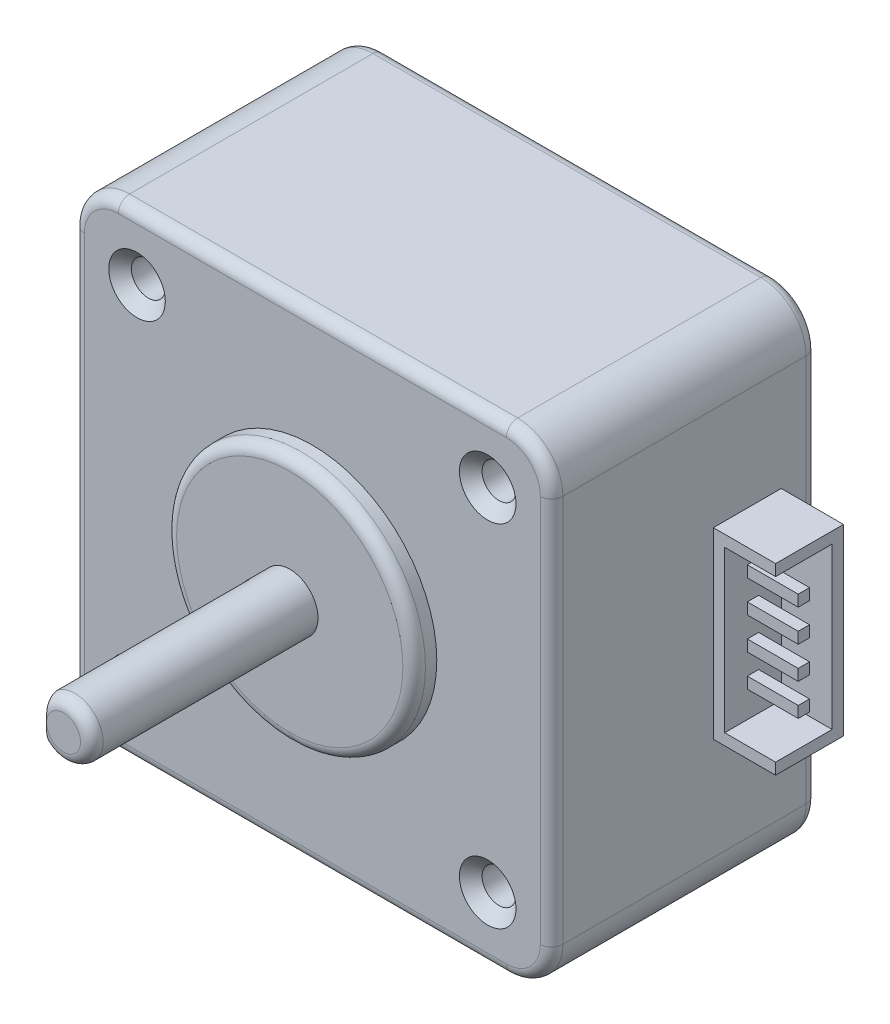
from build123d import *

# Parameters (mm, degrees)
SKETCH1_W                    = 42.3
SKETCH1_H                    = 42.3
BOSS_EXTRUDE1_DEPTH          = 23.5
FILLET1_R                    = 4
SKETCH2_R                    = 1.5
CUT_EXTRUDE1_DEPTH           = 5
CHAMFER1_SIZE                = 1
CIRPATTERN1_COUNT            = 4
CHAMFER1_OF_CIRPATTERN1_SIZE = 1
SKETCH3_R                    = 11
BOSS_EXTRUDE2_DEPTH          = 2
SKETCH4_R                    = 2.5
BOSS_EXTRUDE3_DEPTH          = 20
FILLET2_R                    = 1
SKETCH5_W                    = 6
SKETCH5_H                    = 16.2
BOSS_EXTRUDE4_DEPTH          = 1
SKETCH6_W                    = 1
SKETCH6_H                    = 1
BOSS_EXTRUDE5_DEPTH          = 4.5
SKETCH7_W                    = 4
SKETCH7_H                    = 4
CUT_EXTRUDE2_DEPTH           = 18


with BuildPart() as part:
    # Sketch1 → Boss-Extrude1 (new body)
    with BuildSketch(Plane.XY):
        Rectangle(SKETCH1_W, SKETCH1_H)
    extrude(amount=BOSS_EXTRUDE1_DEPTH)

    # Fillet1
    fillet1_edges = [part.edges().sort_by_distance(p)[0] for p in [
        (-21.15, 21.15, 11.75),
        (21.15, 21.15, 11.75),
        (21.15, -21.15, 11.75),
        (-21.15, -21.15, 11.75),
    ]]
    fillet(fillet1_edges, radius=FILLET1_R)

    # Sketch2 → Cut-Extrude1 (cut)
    with BuildSketch(Plane.XY.offset(23.5)):
        with Locations((-15.5, -15.5)):
            Circle(SKETCH2_R)
    cut_extrude1 = extrude(amount=-CUT_EXTRUDE1_DEPTH, mode=Mode.SUBTRACT)

    # Chamfer1
    chamfer1_edges = [part.edges().sort_by_distance(p)[0] for p in [
        (-17, -15.5, 23.5),
    ]]
    chamfer(chamfer1_edges, length=CHAMFER1_SIZE)

    # CirPattern1: Cut-Extrude1 ×4 about axis
    cirpattern1_axis = Axis((0, 0, 23.5), (0, 0, 1))
    for i in range(1, CIRPATTERN1_COUNT):
        add(cut_extrude1.rotate(cirpattern1_axis, i * 360 / CIRPATTERN1_COUNT), mode=Mode.SUBTRACT)

    # Chamfer1 of CirPattern1
    chamfer1_of_cirpattern1_edges = [part.edges().sort_by_distance(p)[0] for p in [
        (15.5, -17, 23.5),
        (17, 15.5, 23.5),
        (-15.5, 17, 23.5),
    ]]
    chamfer(chamfer1_of_cirpattern1_edges, length=CHAMFER1_OF_CIRPATTERN1_SIZE)

    # Sketch3 → Boss-Extrude2 (add)
    with BuildSketch(Plane.XY.offset(23.5)):
        Circle(SKETCH3_R)
    extrude(amount=BOSS_EXTRUDE2_DEPTH)

    # Sketch4 → Boss-Extrude3 (add)
    with BuildSketch(Plane.XY.offset(25.5)):
        Circle(SKETCH4_R)
    extrude(amount=BOSS_EXTRUDE3_DEPTH)

    # Fillet2
    fillet2_edges = [part.edges().sort_by_distance(p)[0] for p in [
        (19.978427125, -19.978427125, 0),
        (0, -21.15, 0),
        (-19.978427125, -19.978427125, 0),
        (-21.15, 0, 0),
        (-19.978427125, 19.978427125, 0),
        (0, 21.15, 0),
        (19.978427125, 19.978427125, 0),
        (19.978427125, 19.978427125, 23.5),
        (21.15, 0, 23.5),
        (19.978427125, -19.978427125, 23.5),
        (0, -21.15, 23.5),
        (-19.978427125, -19.978427125, 23.5),
        (-21.15, 0, 23.5),
        (-19.978427125, 19.978427125, 23.5),
        (21.15, 0, 0),
        (0, 21.15, 23.5),
        (-11, 0, 25.5),
        (-2.5, 0, 45.5),
    ]]
    fillet(fillet2_edges, radius=FILLET2_R)

    # Sketch5 → Boss-Extrude4 (add)
    with BuildSketch(Plane(origin=(21.15, 0, 0), x_dir=(0, 0, -1), z_dir=(1, 0, 0))):
        with Locations((-6.2, 0)):
            Rectangle(SKETCH5_W, SKETCH5_H)
    extrude(amount=BOSS_EXTRUDE4_DEPTH)

    # Sketch6 → Boss-Extrude5 (add)
    with BuildSketch(Plane(origin=(22.15, 0, 0), x_dir=(0, 0, -1), z_dir=(1, 0, 0))):
        Polygon((-9.2, -7.1), (-4.2, -7.1), (-4.2, 7.1), (-9.2, 7.1), (-9.2, 8.1), (-3.2, 8.1), (-3.2, -8.1), (-9.2, -8.1), align=None)
        with Locations((-6.7, -4.26)):
            Rectangle(SKETCH6_W, SKETCH6_H)
        with Locations((-6.7, 1.42)):
            Rectangle(SKETCH6_W, SKETCH6_H)
        with Locations((-6.7, 4.26)):
            Rectangle(SKETCH6_W, SKETCH6_H)
        with Locations((-6.7, -1.42)):
            Rectangle(SKETCH6_W, SKETCH6_H)
    extrude(amount=BOSS_EXTRUDE5_DEPTH)

    # Sketch7 → Cut-Extrude2 (cut)
    with BuildSketch(Plane.XY.offset(45.5)):
        with Locations((-3.5, 0)):
            Rectangle(SKETCH7_W, SKETCH7_H)
    extrude(amount=-CUT_EXTRUDE2_DEPTH, mode=Mode.SUBTRACT)


solid = part.part
